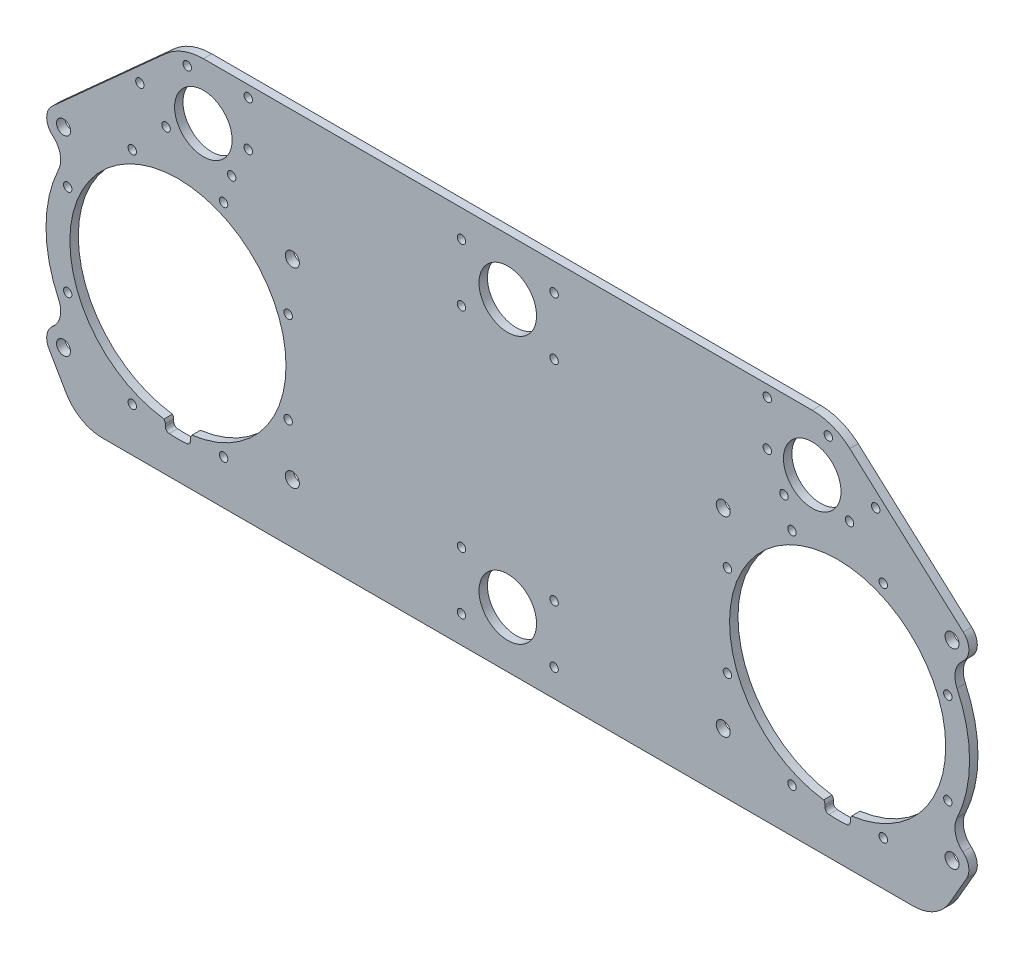
from build123d import *

# Parameters (mm, degrees)
SKETCH_1_R               = 23.74347741
EXTRUDE_1_DEPTH          = 3
CUT_EXTRUDE_1_DEPTH      = 294.143309663
CUT_EXTRUDE_1_DEPTH_BACK = 294.143309663
SKETCH_2_R               = 2.5
CUT_EXTRUDE_2_DEPTH      = 294.143309663
CUT_EXTRUDE_2_DEPTH_BACK = 294.143309663
SKETCH_3_R               = 1.5
CUT_EXTRUDE_3_DEPTH      = 294.143309663
CUT_EXTRUDE_3_DEPTH_BACK = 294.143309663
SKETCH_4_R               = 10.25
CUT_EXTRUDE_4_DEPTH      = 294.143309663
CUT_EXTRUDE_4_DEPTH_BACK = 294.143309663
SKETCH_5_R               = 1.5
CUT_EXTRUDE_5_DEPTH      = 294.143309663
CUT_EXTRUDE_5_DEPTH_BACK = 294.143309663
SKETCH_6_R               = 1.5
CUT_EXTRUDE_6_DEPTH      = 294.143309663
CUT_EXTRUDE_6_DEPTH_BACK = 294.143309663
SKETCH_7_R               = 1.5


with BuildPart() as part:
    # 草图1 → 凸台-拉伸1 (new body)
    with BuildSketch(Plane.XY):
        with BuildLine():
            Line((44.764783638, 38.458868953), (4.334015044, 74.86289651))
            ThreePointArc((4.334015044, 74.86289651), (-1.881238093, 78.67160853), (-9.048597084, 80))
            Line((-9.048597084, 80), (-225.951402916, 80))
            ThreePointArc((-225.951402916, 80), (-233.118761907, 78.67160853), (-239.334015044, 74.86289651))
            Line((-239.334015044, 74.86289651), (-279.764783638, 38.458868953))
            ThreePointArc((-279.764783638, 38.458868953), (-281.748934241, 33.886916076), (-279.593885752, 29.392989871))
            ThreePointArc((-279.593885752, 29.392989871), (-276.958783906, 25.06173547), (-277.521429039, 20.023188369))
            ThreePointArc((-277.521429039, 20.023188369), (-282, 0), (-277.521429039, -20.023188369))
            ThreePointArc((-277.521429039, -20.023188369), (-276.958783906, -25.06173547), (-279.593885752, -29.392989871))
            ThreePointArc((-279.593885752, -29.392989871), (-281.657387183, -32.949868258), (-280.946152423, -37))
            Line((-280.946152423, -37), (-274.883974596, -47.5))
            ThreePointArc((-274.883974596, -47.5), (-269.393593539, -52.990381057), (-261.893593539, -55))
            Line((-261.893593539, -55), (26.893593539, -55))
            ThreePointArc((26.893593539, -55), (34.393593539, -52.990381057), (39.883974596, -47.5))
            Line((39.883974596, -47.5), (45.946152423, -37))
            ThreePointArc((45.946152423, -37), (46.657387183, -32.949868258), (44.593885752, -29.392989871))
            ThreePointArc((44.593885752, -29.392989871), (41.958783906, -25.06173547), (42.521429039, -20.023188369))
            ThreePointArc((42.521429039, -20.023188369), (47, 0), (42.521429039, 20.023188369))
            ThreePointArc((42.521429039, 20.023188369), (41.958783906, 25.06173547), (44.593885752, 29.392989871))
            ThreePointArc((44.593885752, 29.392989871), (46.748934241, 33.886916076), (44.764783638, 38.458868953))
        make_face()
        Circle(SKETCH_1_R, mode=Mode.SUBTRACT)
        with Locations((-235, 0)):
            Circle(SKETCH_1_R, mode=Mode.SUBTRACT)
    extrude(amount=EXTRUDE_1_DEPTH)

    # 草图2 → 切除-拉伸1 (cut, two sides: drawn at the far end of the back side and taken through both)
    with BuildSketch(Plane(origin=(0, 0, 0), x_dir=(-1, 0, 0), z_dir=(0, 0, -1)).offset(-CUT_EXTRUDE_1_DEPTH_BACK)):
        with Locations((40.75, -34)):
            Circle(SKETCH_2_R)
        with Locations((40.75, 34)):
            Circle(SKETCH_2_R)
        with Locations((-40.75, 34)):
            Circle(SKETCH_2_R)
        with Locations((-40.75, -34)):
            Circle(SKETCH_2_R)
        with Locations((275.75, -34)):
            Circle(SKETCH_2_R)
        with Locations((275.75, 34)):
            Circle(SKETCH_2_R)
        with Locations((194.25, 34)):
            Circle(SKETCH_2_R)
        with Locations((194.25, -34)):
            Circle(SKETCH_2_R)
    extrude(amount=CUT_EXTRUDE_1_DEPTH + CUT_EXTRUDE_1_DEPTH_BACK, mode=Mode.SUBTRACT)

    # 草图3 → 切除-拉伸2 (cut, two sides: drawn at the far end of the back side and taken through both)
    with BuildSketch(Plane.XY.offset(3).offset(-CUT_EXTRUDE_2_DEPTH_BACK)):
        with Locations((-251.264045876, 39.264880132)):
            Circle(SKETCH_3_R)
        with Locations((-274.264880132, 16.264045876)):
            Circle(SKETCH_3_R)
        with Locations((-274.264880132, -16.264045876)):
            Circle(SKETCH_3_R)
        with Locations((-251.264045876, -39.264880132)):
            Circle(SKETCH_3_R)
        with Locations((-218.735954124, 39.264880132)):
            Circle(SKETCH_3_R)
        with Locations((-195.735119868, 16.264045876)):
            Circle(SKETCH_3_R)
        with Locations((-195.735119868, -16.264045876)):
            Circle(SKETCH_3_R)
        with Locations((-218.735954124, -39.264880132)):
            Circle(SKETCH_3_R)
        with Locations((-16.264045876, -39.264880132)):
            Circle(SKETCH_3_R)
        with Locations((-39.264880132, -16.264045876)):
            Circle(SKETCH_3_R)
        with Locations((-39.264880132, 16.264045876)):
            Circle(SKETCH_3_R)
        with Locations((-16.264045876, 39.264880132)):
            Circle(SKETCH_3_R)
        with Locations((16.264045876, 39.264880132)):
            Circle(SKETCH_3_R)
        with Locations((39.264880132, 16.264045876)):
            Circle(SKETCH_3_R)
        with Locations((39.264880132, -16.264045876)):
            Circle(SKETCH_3_R)
        with Locations((16.264045876, -39.264880132)):
            Circle(SKETCH_3_R)
        with BuildLine():
            Line((-239.500175319, -39.468321754), (-239.500178729, -40.236009311))
            ThreePointArc((-239.500178729, -40.236009311), (-239.099568481, -41.256477718), (-238.111715855, -41.731863382))
            ThreePointArc((-238.111715855, -41.731863382), (-235.000000357, -41.847714357), (-231.888284858, -41.731863435))
            ThreePointArc((-231.888284858, -41.731863435), (-230.900432223, -41.256477788), (-230.499821958, -40.236009387))
            Line((-230.499821958, -40.236009387), (-230.499825355, -39.468321831))
            ThreePointArc((-230.499825355, -39.468321831), (-230.378047604, -38.781085812), (-230.027538462, -38.177540862))
            ThreePointArc((-230.027538462, -38.177540862), (-234.999999671, 38.5), (-239.97246219, -38.177540777))
            ThreePointArc((-239.97246219, -38.177540777), (-239.621953058, -38.781085733), (-239.500175319, -39.468321754))
        make_face()
        with BuildLine():
            Line((-4.500175319, -39.468321754), (-4.500178729, -40.236009311))
            ThreePointArc((-4.500178729, -40.236009311), (-4.099568481, -41.256477718), (-3.111715855, -41.731863382))
            ThreePointArc((-3.111715855, -41.731863382), (-3.57e-07, -41.847714357), (3.111715142, -41.731863435))
            ThreePointArc((3.111715142, -41.731863435), (4.099567777, -41.256477788), (4.500178042, -40.236009387))
            Line((4.500178042, -40.236009387), (4.500174645, -39.468321831))
            ThreePointArc((4.500174645, -39.468321831), (4.621952396, -38.781085812), (4.972461538, -38.177540862))
            ThreePointArc((4.972461538, -38.177540862), (3.29e-07, 38.5), (-4.97246219, -38.177540777))
            ThreePointArc((-4.97246219, -38.177540777), (-4.621953058, -38.781085733), (-4.500175319, -39.468321754))
        make_face()
    extrude(amount=CUT_EXTRUDE_2_DEPTH + CUT_EXTRUDE_2_DEPTH_BACK, mode=Mode.SUBTRACT)

    # 草图4 → 切除-拉伸3 (cut, two sides: drawn at the far end of the back side and taken through both)
    with BuildSketch(Plane(origin=(0, 0, 0), x_dir=(-1, 0, 0), z_dir=(0, 0, -1)).offset(-CUT_EXTRUDE_3_DEPTH_BACK)):
        with Locations((225.951402916, 60)):
            Circle(SKETCH_4_R)
        with Locations((9.048597084, 60)):
            Circle(SKETCH_4_R)
        with Locations((117.5, -35)):
            Circle(SKETCH_4_R)
        with Locations((117.5, 60)):
            Circle(SKETCH_4_R)
    extrude(amount=CUT_EXTRUDE_3_DEPTH + CUT_EXTRUDE_3_DEPTH_BACK, mode=Mode.SUBTRACT)

    # 草图5 → 切除-拉伸4 (cut, two sides: drawn at the far end of the back side and taken through both)
    with BuildSketch(Plane.XY.offset(3).offset(-CUT_EXTRUDE_4_DEPTH_BACK)):
        with Locations((-134, -24.75)):
            Circle(SKETCH_5_R)
        with Locations((-134, -45.25)):
            Circle(SKETCH_5_R)
        with Locations((-101, -45.25)):
            Circle(SKETCH_5_R)
        with Locations((-101, -24.75)):
            Circle(SKETCH_5_R)
    extrude(amount=CUT_EXTRUDE_4_DEPTH + CUT_EXTRUDE_4_DEPTH_BACK, mode=Mode.SUBTRACT)

    # 草图6 → 切除-拉伸5 (cut, two sides: drawn at the far end of the back side and taken through both)
    with BuildSketch(Plane.XY.offset(3).offset(-CUT_EXTRUDE_5_DEPTH_BACK)):
        with Locations((-209.951402916, 76)):
            Circle(SKETCH_6_R)
        with Locations((-209.951402916, 60)):
            Circle(SKETCH_6_R)
        with Locations((-215.871834176, 48.891341485)):
            Circle(SKETCH_6_R)
        with Locations((-231.685290109, 74.937286824)):
            Circle(SKETCH_6_R)
        with Locations((-248.547809826, 61.184227506)):
            Circle(SKETCH_6_R)
        with Locations((-239.229232955, 52.329375962)):
            Circle(SKETCH_6_R)
        with Locations((4.229232955, 52.329375962)):
            Circle(SKETCH_6_R)
        with Locations((-19.128165824, 48.891341485)):
            Circle(SKETCH_6_R)
        with Locations((-25.048597084, 60)):
            Circle(SKETCH_6_R)
        with Locations((-25.048597084, 76)):
            Circle(SKETCH_6_R)
        with Locations((-3.314709891, 74.937286824)):
            Circle(SKETCH_6_R)
        with Locations((13.547809826, 61.184227506)):
            Circle(SKETCH_6_R)
    extrude(amount=CUT_EXTRUDE_5_DEPTH + CUT_EXTRUDE_5_DEPTH_BACK, mode=Mode.SUBTRACT)

    # 草图7 → 切除-拉伸6 (cut, two sides: drawn at the far end of the back side and taken through both)
    with BuildSketch(Plane.XY.offset(3).offset(-CUT_EXTRUDE_6_DEPTH_BACK)):
        with Locations((-134, 49.75)):
            Circle(SKETCH_7_R)
        with Locations((-134, 70.25)):
            Circle(SKETCH_7_R)
        with Locations((-101, 70.25)):
            Circle(SKETCH_7_R)
        with Locations((-101, 49.75)):
            Circle(SKETCH_7_R)
    extrude(amount=CUT_EXTRUDE_6_DEPTH + CUT_EXTRUDE_6_DEPTH_BACK, mode=Mode.SUBTRACT)


solid = part.part
